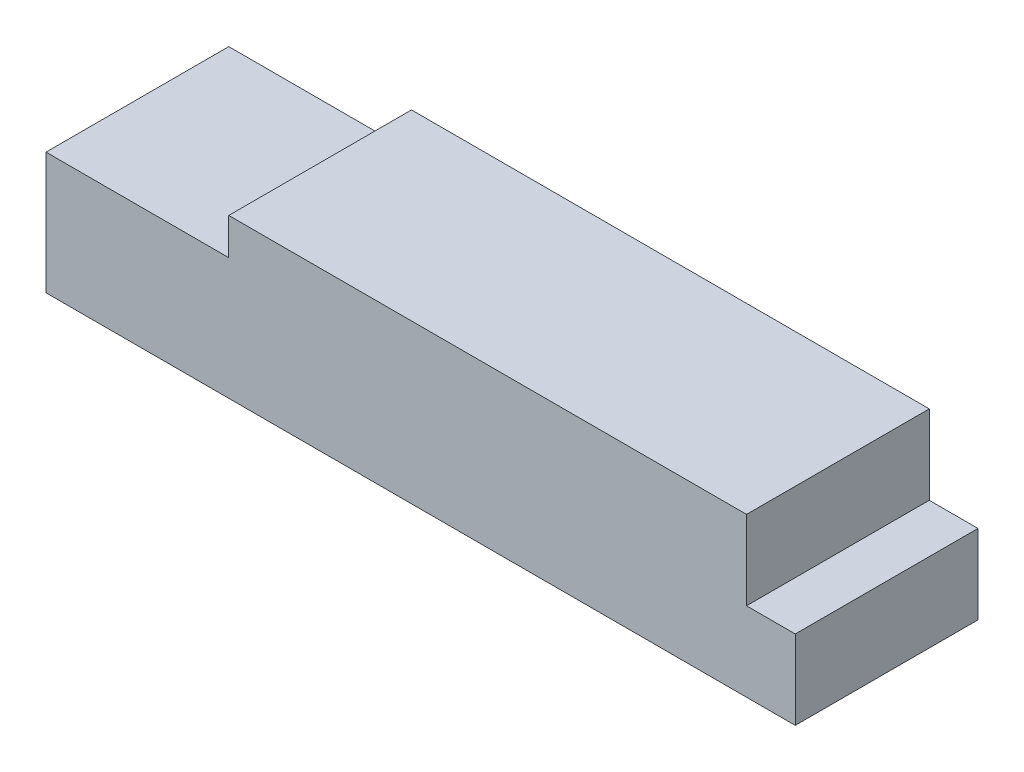
from build123d import *

# Parameters (mm, degrees)
ESTRUSIONE_ESTRUSIONE1_DEPTH = 15


with BuildPart() as part:
    # Schizzo1 → Estrusione-Estrusione1 (new, symmetric)
    with BuildSketch(Plane.XY):
        Polygon((0, 0), (123, 0), (123, 13), (115, 13), (115, 26), (30, 26), (30, 20), (0, 20), align=None)
    extrude(amount=ESTRUSIONE_ESTRUSIONE1_DEPTH, both=True)


solid = part.part
